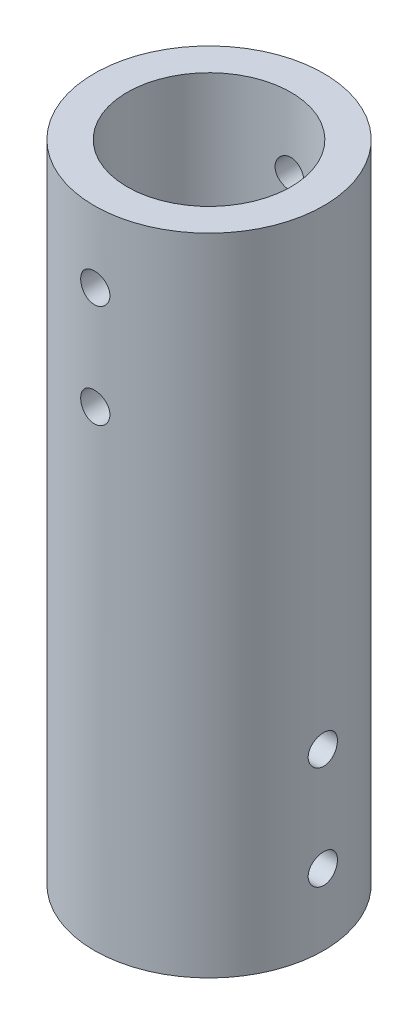
from build123d import *

# Parameters (mm, degrees)
SKETCH1_R               = 13.335
SKETCH1_R_2             = 9.525
BOSS_EXTRUDE1_DEPTH     = 75
CUT_EXTRUDE1_DEPTH      = 78.334626462
CUT_EXTRUDE1_DEPTH_BACK = 78.334626462
SKETCH4_R               = 1.7
CUT_EXTRUDE2_DEPTH      = 78.334626598
CUT_EXTRUDE2_DEPTH_BACK = 78.334626598
SKETCH7_R               = 1.7


with BuildPart() as part:
    # Sketch1 → Boss-Extrude1 (new body)
    with BuildSketch(Plane(origin=(0, 0, 0), x_dir=(1, 0, 0), z_dir=(0, 1, 0))):
        with Locations(Location((0, 0, 0), (0, 0, 270))):
            Circle(SKETCH1_R)
        with Locations(Location((0, 0, 0), (0, 0, 270))):
            Circle(SKETCH1_R_2, mode=Mode.SUBTRACT)
    extrude(amount=BOSS_EXTRUDE1_DEPTH)

    # Sketch4 → Cut-Extrude1 (cut, two sides: drawn at the far end of the back side and taken through both)
    with BuildSketch(Plane.XY.offset(-CUT_EXTRUDE1_DEPTH_BACK)):
        with Locations((0, 66.744231704)):
            Circle(SKETCH4_R)
        with Locations((0, 54.744231704)):
            Circle(SKETCH4_R)
    extrude(amount=CUT_EXTRUDE1_DEPTH + CUT_EXTRUDE1_DEPTH_BACK, mode=Mode.SUBTRACT)

    # Sketch7 → Cut-Extrude2 (cut, two sides: drawn at the far end of the back side and taken through both)
    with BuildSketch(Plane(origin=(0, 0, 0), x_dir=(0, 0, -1), z_dir=(1, 0, 0)).offset(-CUT_EXTRUDE2_DEPTH_BACK)):
        with Locations((0, 8.26)):
            Circle(SKETCH7_R)
        with Locations((0, 20.26)):
            Circle(SKETCH7_R)
    extrude(amount=CUT_EXTRUDE2_DEPTH + CUT_EXTRUDE2_DEPTH_BACK, mode=Mode.SUBTRACT)


solid = part.part
